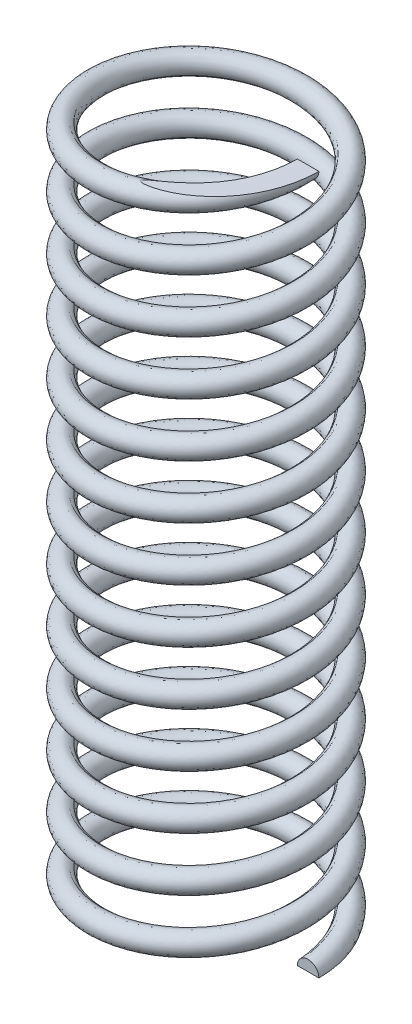
from build123d import *

# Parameters (mm, degrees)
SWEEP1_PITCH       = 10
SWEEP1_HEIGHT      = 130
SWEEP1_RADIUS      = 19
SWEEP1_START_ANGLE = 90
SKETCH2_R          = 2
CUT_EXTRUDE1_REACH = 137.3
SKETCH3_R          = 50
CUT_EXTRUDE2_REACH = 137.3
SKETCH4_R          = 35


with BuildPart() as part:
    # Sweep1: sweep along a helix
    with BuildLine() as sweep1_path:
        add(Helix(SWEEP1_PITCH, SWEEP1_HEIGHT, SWEEP1_RADIUS, center=(0, 0, 0), direction=(0, 1, 0), mode=Mode.PRIVATE).rotate(Axis((0, 0, 0), (0, 1, 0)), SWEEP1_START_ANGLE))
    # Sketch2 → Sweep1 (sweep)
    with BuildSketch(Plane.XY):
        with Locations((19, 0)):
            Circle(SKETCH2_R)
    sweep(path=sweep1_path.line, is_frenet=True)

    # Sketch3 → Cut-Extrude1 (cut, up to next)
    with BuildSketch(Plane(origin=(0, 0, 0), x_dir=(1, 0, 0), z_dir=(0, 1, 0)), mode=Mode.PRIVATE) as cut_extrude1_sk1:
        Circle(SKETCH3_R)
    cut_extrude1_tool1 = extrude(cut_extrude1_sk1.sketch, amount=-CUT_EXTRUDE1_REACH, mode=Mode.PRIVATE) & part.part
    add(cut_extrude1_tool1.solids().sort_by_distance((0, 0, 0))[0], mode=Mode.SUBTRACT)

    # Sketch4 → Cut-Extrude2 (cut, up to next)
    with BuildSketch(Plane(origin=(0, 130, 0), x_dir=(-1, 0, 0), z_dir=(0, 1, 0)), mode=Mode.PRIVATE) as cut_extrude2_sk1:
        Circle(SKETCH4_R)
    cut_extrude2_tool1 = extrude(cut_extrude2_sk1.sketch, amount=CUT_EXTRUDE2_REACH, mode=Mode.PRIVATE) & part.part
    add(cut_extrude2_tool1.solids().sort_by_distance((0, 130, 0))[0], mode=Mode.SUBTRACT)


solid = part.part
